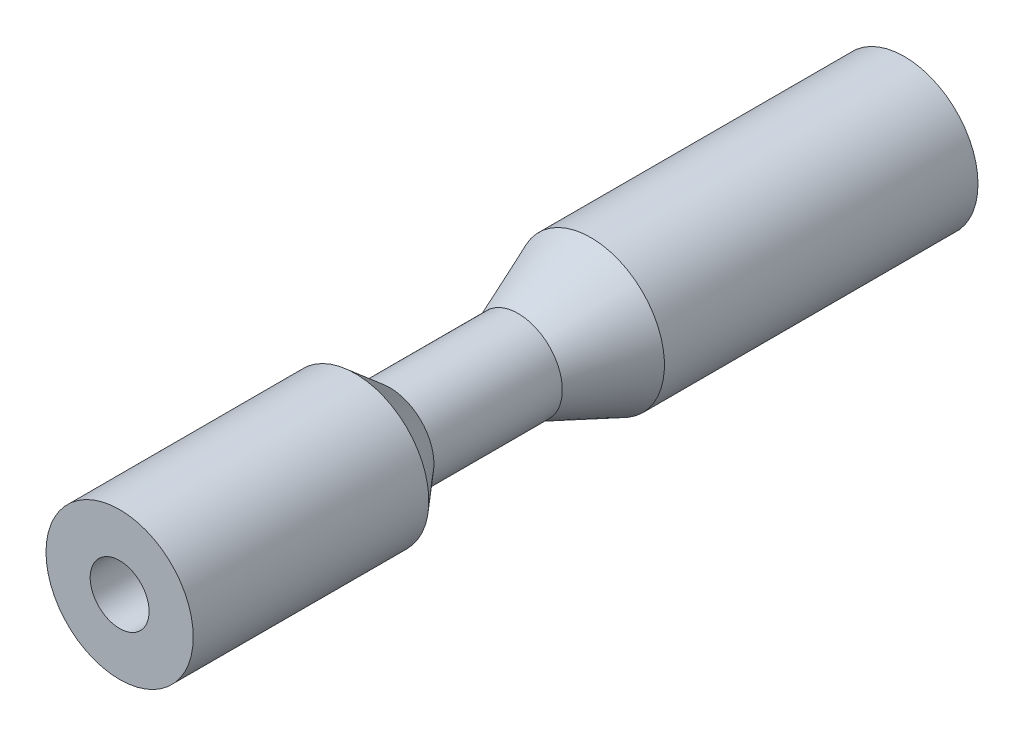
from build123d import *

# Parameters (mm, degrees)
SKETCH1_R                    = 2.5
BOSS_EXTRUDE1_DEPTH          = 27
CHAMFER1_SIZE                = 2
CHAMFER1_SIZE2               = 0.352653961
F_2_0_2_DIAMETER_HOLE1_D     = 2
F_2_0_2_DIAMETER_HOLE1_DEPTH = 26
F_2_0_2_DIAMETER_HOLE1_TIP   = 0.600860619
CUT_EXTRUDE1_REACH           = 29.23
SKETCH6_R                    = 0.25


with BuildPart() as part:
    # Sketch1 → Boss-Extrude1 (new body)
    with BuildSketch(Plane.XY):
        Circle(SKETCH1_R)
    extrude(amount=BOSS_EXTRUDE1_DEPTH)

    # Sketch3 → Cut-Revolve1 (revolve, cut)
    with BuildSketch(Plane(origin=(0, 0, 0), x_dir=(1, 0, 0), z_dir=(0, 1, 0)), mode=Mode.PRIVATE) as cut_revolve1_sk:
        Polygon((2.5, -11), (1.5, -13.467842271), (1.5, -17.827676266), (2.5, -19), (3.138230266, -19), (3.138230266, -11), align=None)
    revolve(cut_revolve1_sk.sketch.rotate(Axis((0, 0, 0), (0, 0, 1)), 180), axis=Axis((0, 0, 0), (0, 0, 1)), mode=Mode.SUBTRACT)

    # Chamfer1
    chamfer1_edges = [part.edges().sort_by_distance(p)[0] for p in [
        (-2.5, 0, 0),
    ]]
    chamfer1_side = [part.faces().sort_by_distance(p)[0] for p in [
        (0, 0, 0),
    ]]
    chamfer(chamfer1_edges, length=CHAMFER1_SIZE, length2=CHAMFER1_SIZE2, reference=chamfer1_side[0])

    # Ø2.0 (2) Diameter Hole1
    with Locations(Plane.XY.offset(27)):
        with Locations((0, 0)):
            Hole(F_2_0_2_DIAMETER_HOLE1_D / 2, depth=F_2_0_2_DIAMETER_HOLE1_DEPTH)
            with Locations((0, 0, -(F_2_0_2_DIAMETER_HOLE1_DEPTH + F_2_0_2_DIAMETER_HOLE1_TIP / 2))):  # 118° drill point
                Cone(0, F_2_0_2_DIAMETER_HOLE1_D / 2, F_2_0_2_DIAMETER_HOLE1_TIP, mode=Mode.SUBTRACT)

    # Cut-Extrude1: up to this cone (the profile starts outside it)
    cut_extrude1_end = Plane(origin=(0, 0, 0), z_dir=(0, 0, 1)).offset(0.399140381) * Cone(1.664e-06, 48.814749528, 29.330859619, align=(Align.CENTER, Align.CENTER, Align.MIN), mode=Mode.PRIVATE)
    # Sketch6 → Cut-Extrude1 (cut, up to the surface)
    with BuildSketch(Plane(origin=(0, 0, 0), x_dir=(-1, 0, 0), z_dir=(0, 0, -1)), mode=Mode.PRIVATE) as cut_extrude1_sk1:
        Circle(SKETCH6_R)
    cut_extrude1_tool1 = extrude(cut_extrude1_sk1.sketch, amount=-CUT_EXTRUDE1_REACH, mode=Mode.PRIVATE) - cut_extrude1_end
    add(cut_extrude1_tool1.solids().sort_by_distance((0, 0, 0))[0], mode=Mode.SUBTRACT)


solid = part.part
